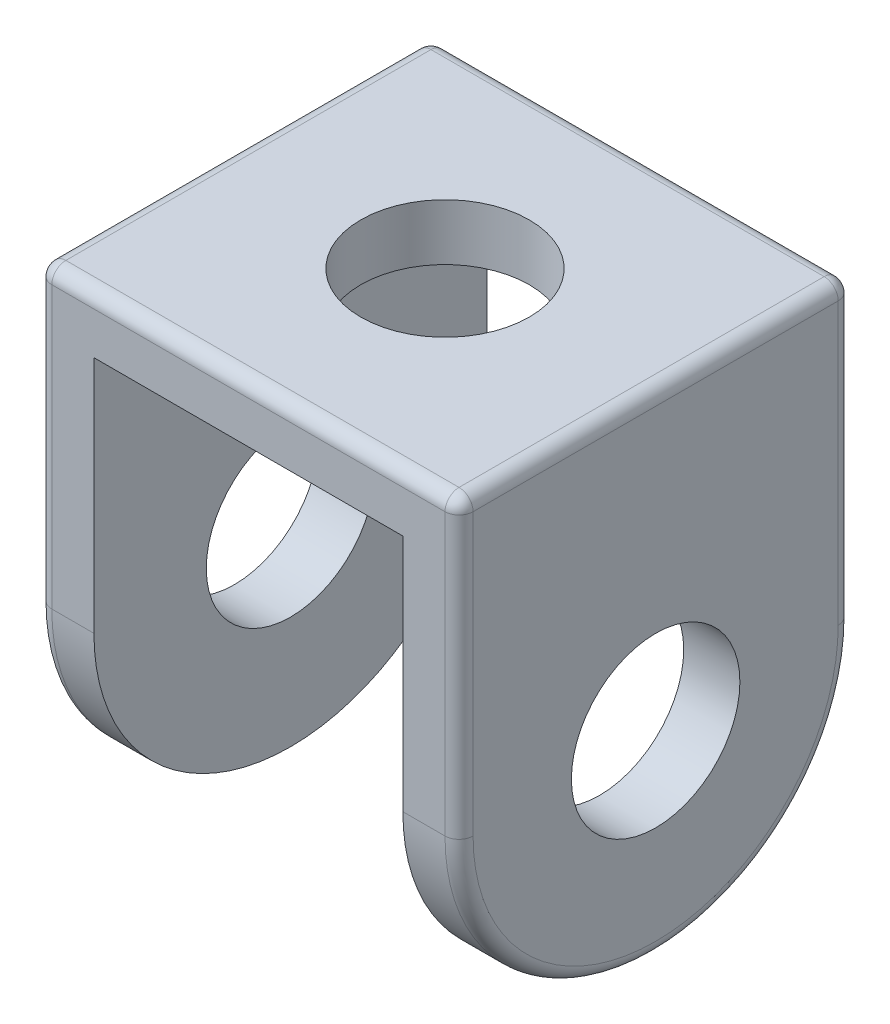
from build123d import *

# Parameters (mm, degrees)
SKETCH_1_R          = 6
EXTRUDE_1_DEPTH     = 30
SKETCH_2_W          = 22
SKETCH_2_H          = 31
CUT_EXTRUDE_2_DEPTH = 54.935146241
SKETCH_3_R          = 6
CUT_EXTRUDE_3_DEPTH = 30
FILLET_1_R          = 1


with BuildPart() as part:
    # 草图1 → 拉伸1 (new body)
    with BuildSketch(Plane(origin=(0, 0, 0), x_dir=(0, 0, -1), z_dir=(1, 0, 0))):
        with BuildLine():
            Line((0, 0), (0, -21))
            ThreePointArc((0, -21), (14, -35), (28, -21))
            Line((28, -21), (28, 0))
            Line((28, 0), (0, 0))
        make_face()
        with Locations((14, -21)):
            Circle(SKETCH_1_R, mode=Mode.SUBTRACT)
    extrude(amount=EXTRUDE_1_DEPTH)

    # 草图2 → 拉伸2 (cut, through all)
    with BuildSketch(Plane.XY):
        with Locations((15, -19.5)):
            Rectangle(SKETCH_2_W, SKETCH_2_H)
    extrude(amount=-CUT_EXTRUDE_2_DEPTH, mode=Mode.SUBTRACT)

    # 草图3 → 拉伸3 (cut)
    with BuildSketch(Plane(origin=(0, 0, 0), x_dir=(1, 0, 0), z_dir=(0, 1, 0))):
        with Locations(Location((15, 14, 0), (0, 0, 270))):
            Circle(SKETCH_3_R)
    extrude(amount=-CUT_EXTRUDE_3_DEPTH, mode=Mode.SUBTRACT)

    # 圆角1
    fillet_1_edges = [part.edges().sort_by_distance(p)[0] for p in [
        (30, -35, -14),
        (30, -10.5, -28),
        (30, 0, -14),
        (0, -10.5, -28),
        (0, -35, -14),
        (0, -10.5, 0),
        (0, 0, -14),
        (30, -10.5, 0),
        (15, 0, -28),
        (15, 0, 0),
    ]]
    fillet(fillet_1_edges, radius=FILLET_1_R)


solid = part.part
